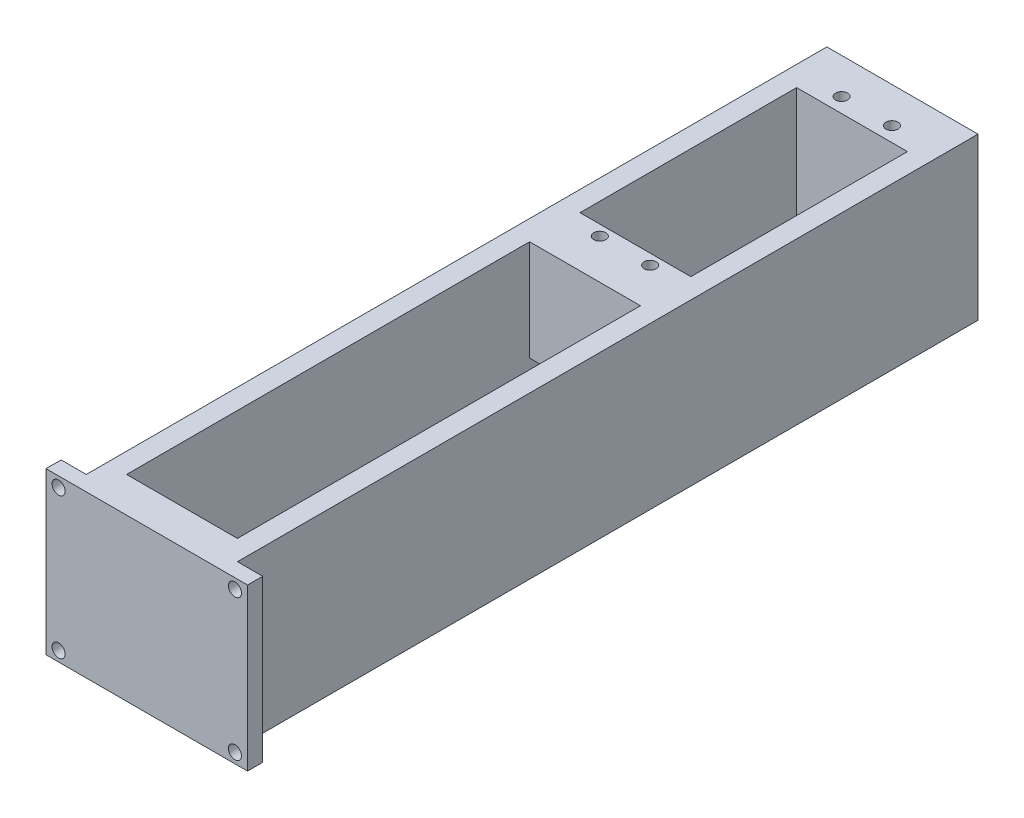
from build123d import *

# Parameters (mm, degrees)
SKETCH1_W               = 30
SKETCH1_H               = 150
BOSS_EXTRUDE1_DEPTH     = 40
CUT_EXTRUDE1_DEPTH      = 159.113883008
CUT_EXTRUDE1_DEPTH_BACK = 30
SKETCH2_W               = 22
SKETCH2_H               = 43
SKETCH4_W               = 22
SKETCH4_H               = 10
CUT_EXTRUDE2_DEPTH      = 20
CUT_EXTRUDE3_DEPTH      = 159.113883008
CUT_EXTRUDE3_DEPTH_BACK = 159.113883008
SKETCH5_W               = 150
SKETCH5_H               = 8
SKETCH6_R               = 1.2
CUT_EXTRUDE4_DEPTH      = 10
SKETCH7_W               = 40
SKETCH7_H               = 32
BOSS_EXTRUDE2_DEPTH     = 3
SKETCH8_R               = 1.3
CUT_EXTRUDE5_DEPTH      = 157.31378698
SKETCH9_W               = 22
SKETCH9_H               = 80
CUT_EXTRUDE6_DEPTH      = 158.318148985


with BuildPart() as part:
    # Sketch1 → Boss-Extrude1 (new body)
    with BuildSketch(Plane(origin=(0, 0, 0), x_dir=(1, 0, 0), z_dir=(0, 1, 0))):
        with Locations((15, 75)):
            Rectangle(SKETCH1_W, SKETCH1_H)
    extrude(amount=BOSS_EXTRUDE1_DEPTH)

    # Sketch2 → Cut-Extrude1 (cut, two sides: drawn at the far end of the back side and taken through both)
    with BuildSketch(Plane(origin=(0, 40, 0), x_dir=(1, 0, 0), z_dir=(0, 1, 0)).offset(-CUT_EXTRUDE1_DEPTH_BACK)):
        with Locations((15, 118.5)):
            Rectangle(SKETCH2_W, SKETCH2_H)
    extrude(amount=CUT_EXTRUDE1_DEPTH + CUT_EXTRUDE1_DEPTH_BACK, mode=Mode.SUBTRACT)

    # Sketch4 → Cut-Extrude2 (cut)
    with BuildSketch(Plane.XZ):
        with Locations((15, -92)):
            Rectangle(SKETCH4_W, SKETCH4_H)
    extrude(amount=-CUT_EXTRUDE2_DEPTH, mode=Mode.SUBTRACT)

    # Sketch5 → Cut-Extrude3 (cut, two sides: drawn at the far end of the back side and taken through both)
    with BuildSketch(Plane.ZY.offset(-CUT_EXTRUDE3_DEPTH_BACK)):
        with Locations((-75, 4)):
            Rectangle(SKETCH5_W, SKETCH5_H)
    extrude(amount=CUT_EXTRUDE3_DEPTH + CUT_EXTRUDE3_DEPTH_BACK, mode=Mode.SUBTRACT)

    # Sketch6 → Cut-Extrude4 (cut)
    with BuildSketch(Plane(origin=(0, 40, 0), x_dir=(1, 0, 0), z_dir=(0, 1, 0))):
        with Locations(Location((10, 142.924700648, 0), (0, 0, 270))):
            Circle(SKETCH6_R)
        with Locations(Location((20, 142.924700648, 0), (0, 0, 270))):
            Circle(SKETCH6_R)
        with Locations(Location((10, 94.924700648, 0), (0, 0, 270))):
            Circle(SKETCH6_R)
        with Locations(Location((20, 94.924700648, 0), (0, 0, 270))):
            Circle(SKETCH6_R)
    extrude(amount=-CUT_EXTRUDE4_DEPTH, mode=Mode.SUBTRACT)

    # Sketch7 → Boss-Extrude2 (add)
    with BuildSketch(Plane.XY):
        with Locations((15, 24)):
            Rectangle(SKETCH7_W, SKETCH7_H)
    extrude(amount=-BOSS_EXTRUDE2_DEPTH)

    # Sketch8 → Cut-Extrude5 (cut, through all)
    with BuildSketch(Plane(origin=(0, 0, -3), x_dir=(-1, 0, 0), z_dir=(0, 0, -1))):
        with Locations((-32.5, 38)):
            Circle(SKETCH8_R)
        with Locations((-32.5, 10)):
            Circle(SKETCH8_R)
        with Locations((2.5, 38)):
            Circle(SKETCH8_R)
        with Locations((2.5, 10)):
            Circle(SKETCH8_R)
    extrude(amount=-CUT_EXTRUDE5_DEPTH, mode=Mode.SUBTRACT)

    # Sketch9 → Cut-Extrude6 (cut, through all)
    with BuildSketch(Plane(origin=(0, 40, 0), x_dir=(1, 0, 0), z_dir=(0, 1, 0))):
        with Locations((15, 47)):
            Rectangle(SKETCH9_W, SKETCH9_H)
    extrude(amount=-CUT_EXTRUDE6_DEPTH, mode=Mode.SUBTRACT)


solid = part.part
